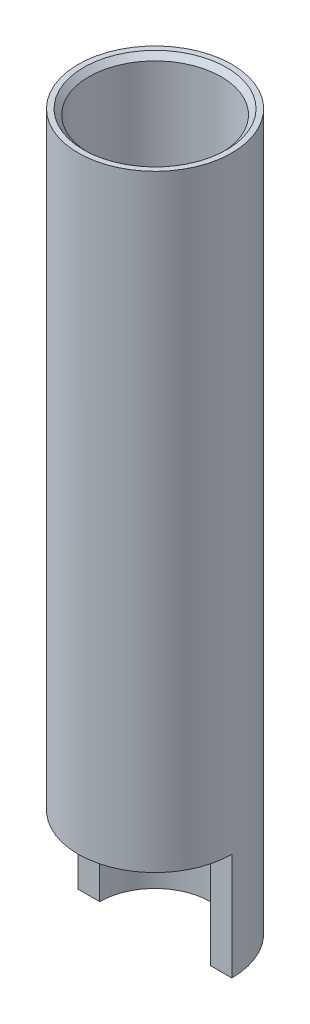
from build123d import *

# Parameters (mm, degrees)
ESBO_O3_W             = 4.788650246
ESBO_O3_H             = 2.452019704
CORTE_EXTRUS_O4_DEPTH = 3
CHANFRO1_SIZE         = 0.15


with BuildPart() as part:
    # Esboço1 → Revolução1 (revolve)
    with BuildSketch(Plane.XY, mode=Mode.PRIVATE) as revolu_o1_sk:
        Polygon((0, 4), (0, 10), (1.85, 11), (1.85, 20), (2.15, 20), (2.15, 0), (1.55, 0), (1.55, 3), align=None)
    revolve(revolu_o1_sk.sketch.rotate(Axis((0, 4, 0), (0, 1, 0)), 90), axis=Axis((0, 4, 0), (0, 1, 0)))

    # Esboço3 → Corte-extrusão4 (cut)
    with BuildSketch(Plane.XZ):
        with Locations((0, 1.226009852)):
            Rectangle(ESBO_O3_W, ESBO_O3_H)
    extrude(amount=-CORTE_EXTRUS_O4_DEPTH, mode=Mode.SUBTRACT)

    # Chanfro1
    chanfro1_edges = [part.edges().sort_by_distance(p)[0] for p in [
        (0, 20, 1.85),
    ]]
    chamfer(chanfro1_edges, length=CHANFRO1_SIZE)


solid = part.part
